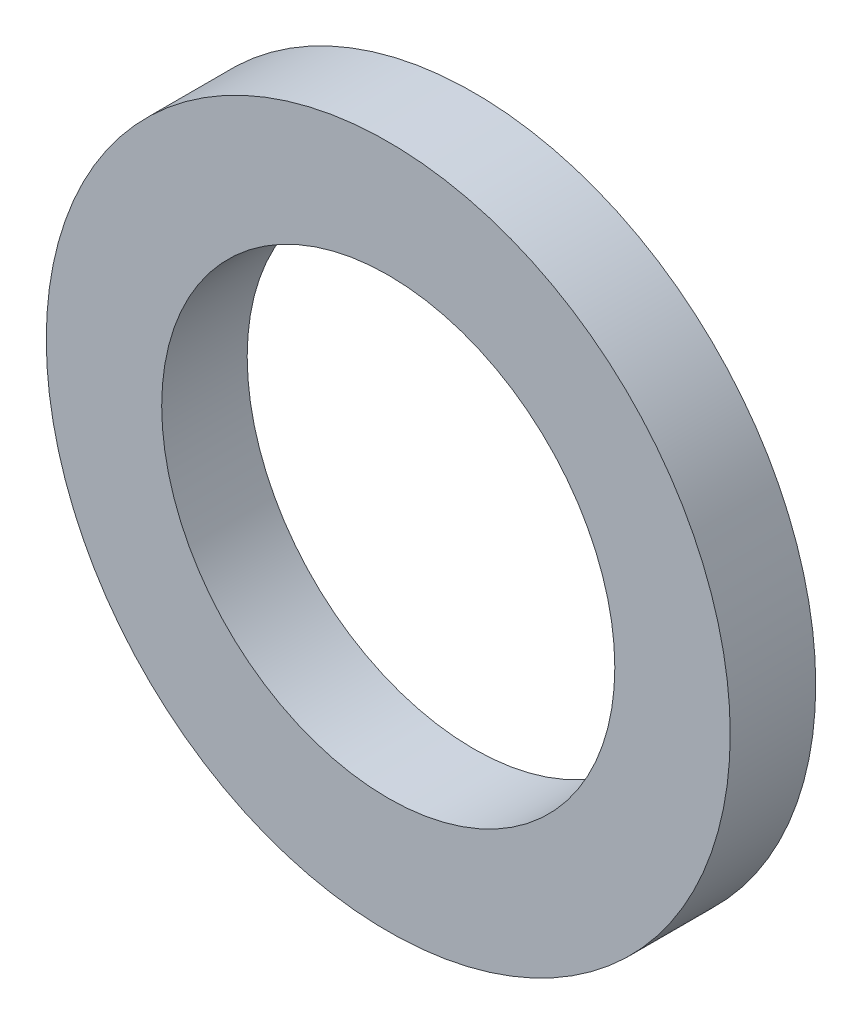
from build123d import *

# Parameters (mm, degrees)
SKETCH1_R           = 4
BOSS_EXTRUDE1_DEPTH = 1
CUT_EXTRUDE1_REACH  = 7.745
SKETCH2_R           = 2.65


with BuildPart() as part:
    # Sketch1 → Boss-Extrude1 (new body)
    with BuildSketch(Plane.XY):
        Circle(SKETCH1_R)
    extrude(amount=BOSS_EXTRUDE1_DEPTH)

    # Sketch2 → Cut-Extrude1 (cut, up to next)
    with BuildSketch(Plane.XY.offset(1), mode=Mode.PRIVATE) as cut_extrude1_sk1:
        Circle(SKETCH2_R)
    cut_extrude1_tool1 = extrude(cut_extrude1_sk1.sketch, amount=-CUT_EXTRUDE1_REACH, mode=Mode.PRIVATE) & part.part
    add(cut_extrude1_tool1.solids().sort_by_distance((0, 0, 1))[0], mode=Mode.SUBTRACT)


solid = part.part
